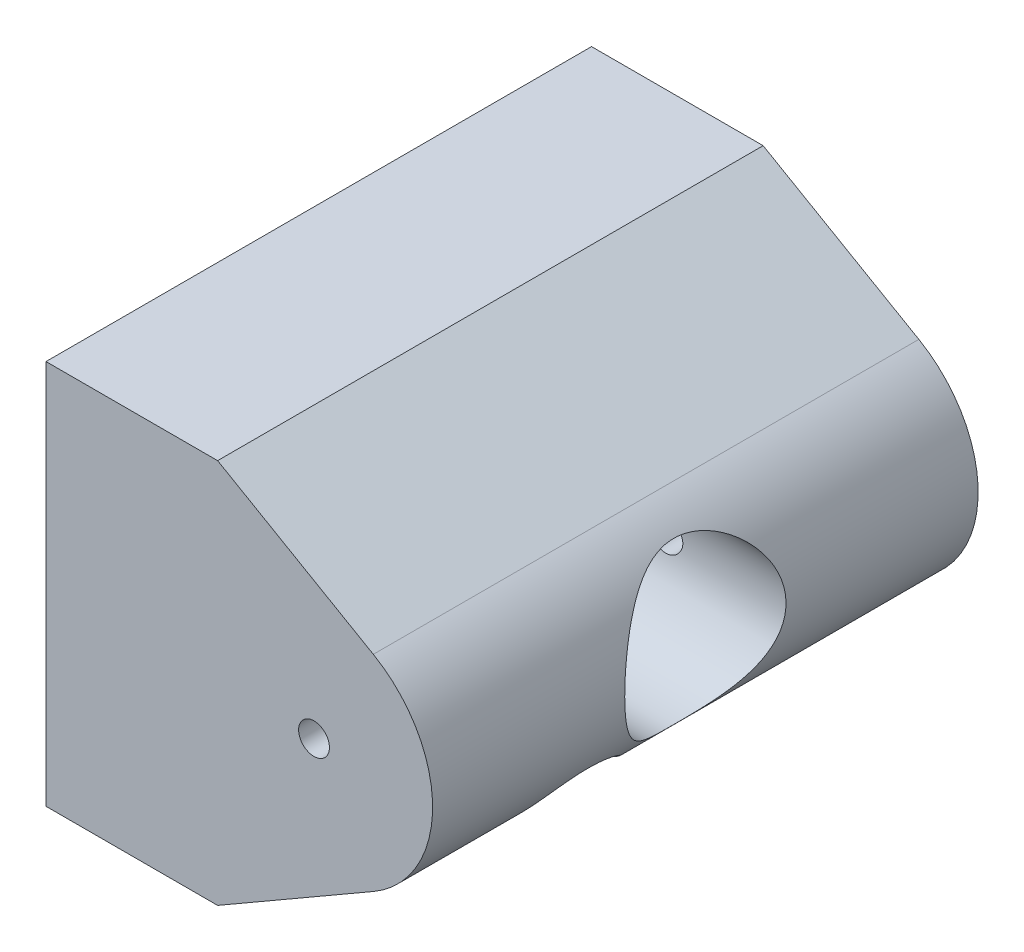
from build123d import *

# Parameters (mm, degrees)
ESQUISSE2_R      = 3.25
EXTRUSION1_DEPTH = 57.5
ESQUISSE5_R      = 17
EXTRUSION3_DEPTH = 108.688718072


with BuildPart() as part:
    # Esquisse2 → Extrusion1 (new, symmetric)
    with BuildSketch(Plane.XY):
        with BuildLine():
            Line((-56.5, 40.6), (-56.5, -40.6))
            Line((-56.5, -40.6), (-20.321262787, -40.6))
            Line((-20.321262787, -40.6), (12.5, -21.650635095))
            ThreePointArc((12.5, -21.650635095), (25, 0), (12.5, 21.650635095))
            Line((12.5, 21.650635095), (-20.321262787, 40.6))
            Line((-20.321262787, 40.6), (-56.5, 40.6))
        make_face()
        Circle(ESQUISSE2_R, mode=Mode.SUBTRACT)
    extrude(amount=EXTRUSION1_DEPTH, both=True)

    # Esquisse5 → Extrusion3 (cut, through all)
    with BuildSketch(Plane.ZY.offset(56.5)):
        Circle(ESQUISSE5_R)
        with BuildLine():
            Line((7.3, -40.6), (7.3, -26.7))
            ThreePointArc((7.3, -26.7), (21.2, -12.8), (35.1, -26.7))
            Line((35.1, -26.7), (35.1, -40.6))
            Line((35.1, -40.6), (7.3, -40.6))
        make_face()
    extrude(amount=-EXTRUSION3_DEPTH, mode=Mode.SUBTRACT)


solid = part.part
